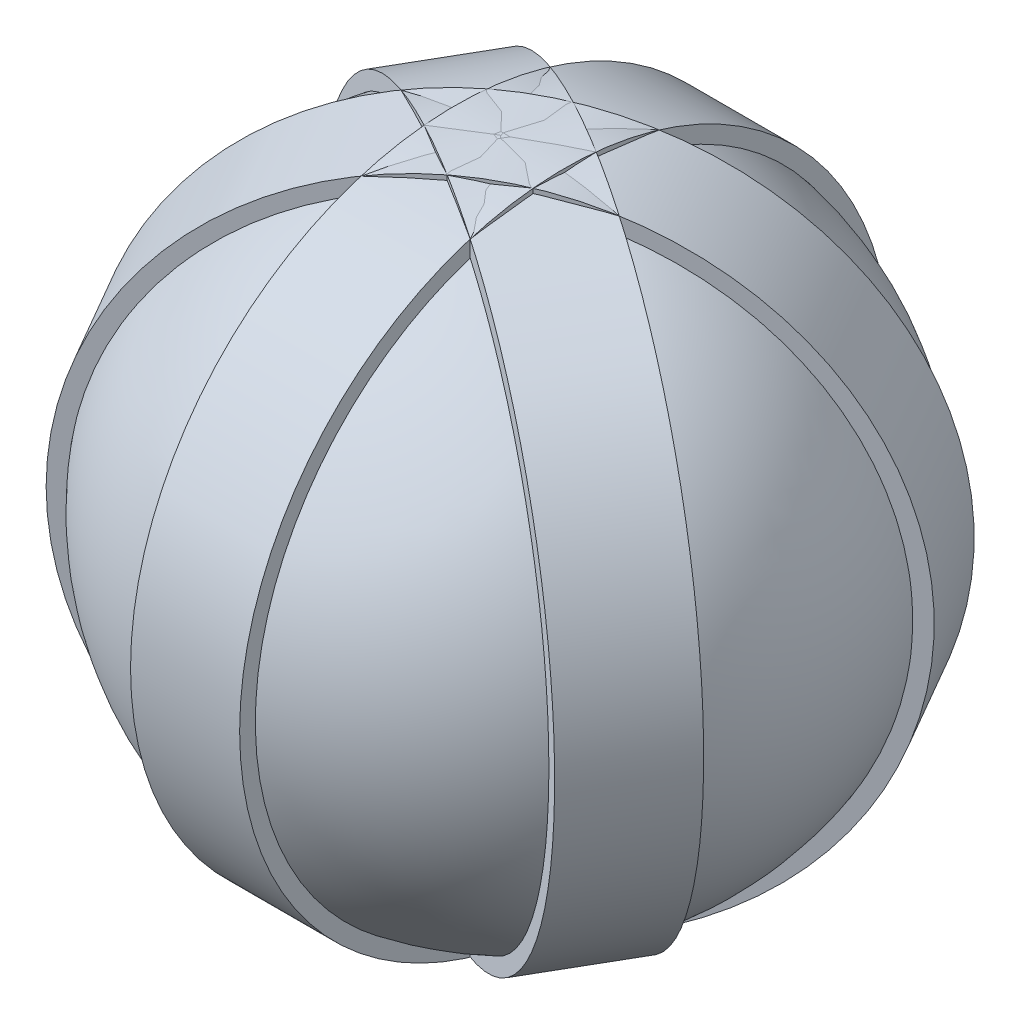
from build123d import *

# Parameters (mm, degrees)
R_P_TITION_CIRCULAIRE3_COUNT = 3
R_P_TITION_CIRCULAIRE3_ANGLE = 120


with BuildPart() as part:
    # Esquisse1 → Révolution1 (revolve)
    with BuildSketch(Plane.XY):
        with BuildLine():
            Line((0, 0), (40, 0))
            ThreePointArc((40, 0), (20, 20), (0, 0))
        make_face()
    revolve(axis=Axis((0, 0, 0), (1, 0, 0)))


with BuildPart() as body_2:
    # Esquisse2 → Révolution2 (revolve)
    with BuildSketch(Plane.XY, mode=Mode.PRIVATE) as r_volution2_sk:
        with BuildLine():
            Line((16.527036447, 19.69615506), (16.527036447, 20.69615506))
            Line((16.527036447, 20.69615506), (23.472963553, 20.69615506))
            Line((23.472963553, 20.69615506), (23.472963553, 19.69615506))
            ThreePointArc((23.472963553, 19.69615506), (20, 20), (16.527036447, 19.69615506))
        make_face()
    revolve(r_volution2_sk.sketch.rotate(Axis((0, 0, 0), (1, 0, 0)), 90), axis=Axis((0, 0, 0), (1, 0, 0)))


with BuildPart() as r_p_tition_circulaire3_1:
    # Répétition circulaire3: pattern copy
    add(body_2.part.rotate(Axis((20, 0, 0), (0, -1, 0)), 1 * R_P_TITION_CIRCULAIRE3_ANGLE / (R_P_TITION_CIRCULAIRE3_COUNT - 1)))


with BuildPart() as r_p_tition_circulaire3_2:
    # Répétition circulaire3: pattern copy
    add(body_2.part.rotate(Axis((20, 0, 0), (0, -1, 0)), 2 * R_P_TITION_CIRCULAIRE3_ANGLE / (R_P_TITION_CIRCULAIRE3_COUNT - 1)))


solid = Compound([part.part, body_2.part, r_p_tition_circulaire3_1.part, r_p_tition_circulaire3_2.part])
